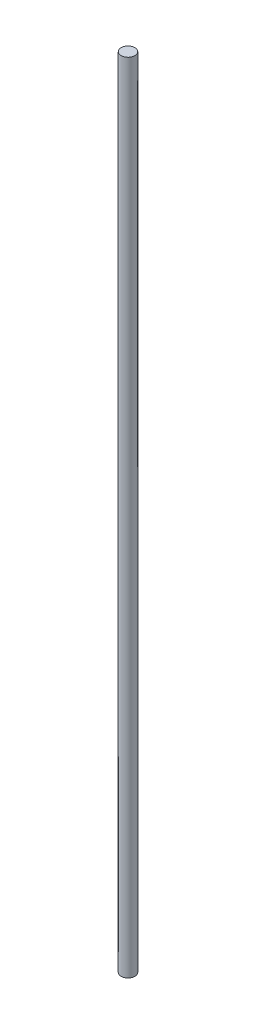
from build123d import *

# Parameters (mm, degrees)
SZKIC1_R                    = 1.125
DODANIE_WYCI_GNI_CIE1_DEPTH = 130


with BuildPart() as part:
    # Szkic1 → Dodanie-wyciągnięcie1 (new body)
    with BuildSketch(Plane(origin=(0, 0, 0), x_dir=(1, 0, 0), z_dir=(0, 1, 0))):
        with Locations(Location((0, 0, 0), (0, 0, 270))):
            Circle(SZKIC1_R)
    extrude(amount=DODANIE_WYCI_GNI_CIE1_DEPTH)


solid = part.part
